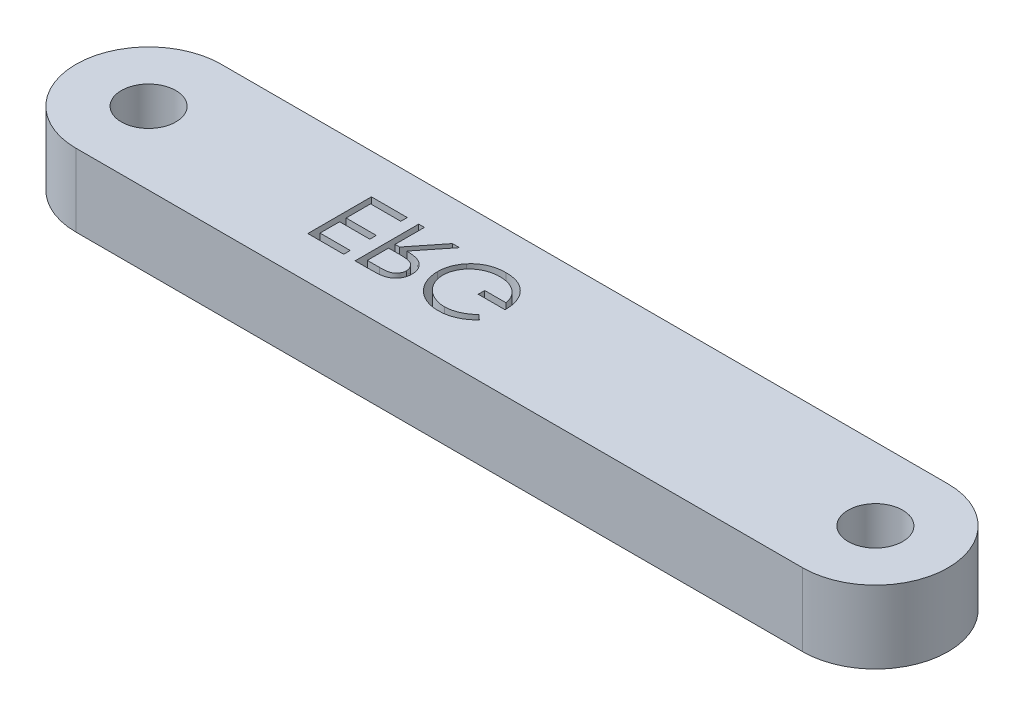
from build123d import *

# Parameters (mm, degrees)
SKETCH2_R           = 15
BOSS_EXTRUDE1_DEPTH = 20
CUT_EXTRUDE1_DEPTH  = 444.621460256


with BuildPart() as part:
    # Sketch2 → Boss-Extrude1 (new, symmetric)
    with BuildSketch(Plane(origin=(0, 0, 0), x_dir=(1, 0, 0), z_dir=(0, 1, 0))):
        with BuildLine():
            Line((0, 40), (400, 40))
            ThreePointArc((400, 40), (440, 0), (400, -40))
            Line((400, -40), (0, -40))
            ThreePointArc((0, -40), (-40, 0), (0, 40))
        make_face()
        with Locations(Location((0, 0, 0), (0, 0, 270))):
            Circle(SKETCH2_R, mode=Mode.SUBTRACT)
        with Locations(Location((400, 0, 0), (0, 0, 270))):
            Circle(SKETCH2_R, mode=Mode.SUBTRACT)
    extrude(amount=BOSS_EXTRUDE1_DEPTH, both=True)

    # Sketch3 → Cut-Extrude1 (cut, through all)
    # profile 1 of 3: a face of its own
    with BuildSketch(Plane.XZ.offset(20)):
        Polygon((104.487179487, 16.860888032), (124.230769231, 16.860888032), (124.230769231, 13.271144442), (107.628205128, 13.271144442), (107.628205128, 2.501913673), (124.230769231, 2.501913673), (124.230769231, -1.087829917), (107.628205128, -1.087829917), (107.628205128, -14.549368378), (124.230769231, -14.549368378), (124.230769231, -18.139111968), (104.487179487, -18.139111968), align=None)
    # profile 2 of 3: a face of its own
    with BuildSketch(Plane.XZ.offset(20)):
        with BuildLine():
            Line((130.512820513, 16.860888032), (137.517027244, 16.860888032))
            add(Edge.make_bspline(
                [(137.517027244, 16.860888032), (137.984438529, 16.859332172), (138.881919973, 16.856344749), (140.167652676, 16.83968712), (141.335923646, 16.791943562), (142.38612204, 16.750857728), (143.318228589, 16.675938314), (144.135101497, 16.604331843), (144.832978472, 16.510595235), (145.255436985, 16.423541006), (145.446714744, 16.384125211)],
                knots=[0, 0, 0, 0, 1.410062039, 2.707475311, 3.878576406, 4.937260626, 5.877586885, 6.699081471, 7.410979367, 8, 8, 8, 8], degree=3))
            add(Edge.make_bspline(
                [(145.446714744, 16.384125211), (145.702780985, 16.320857558), (146.20945088, 16.195671921), (146.93895154, 15.931075913), (147.63409478, 15.624879667), (148.291993023, 15.265242463), (148.909350935, 14.849494667), (149.492534043, 14.384813442), (150.044188676, 13.873741385), (150.542004978, 13.30339297), (151.011395495, 12.705027873), (151.40728176, 12.057990304), (151.748546557, 11.381375029), (152.020251727, 10.668300852), (152.239031462, 9.925683133), (152.393293856, 9.146795166), (152.485805732, 8.335185415), (152.495224288, 7.781606327), (152.5, 7.50091207)],
                knots=[0, 0, 0, 0, 1.027469482, 2.033020251, 3.019912614, 3.986113645, 4.951240523, 5.91722682, 6.890402269, 7.87763091, 8.8651537, 9.85103654, 10.82876324, 11.815024772, 12.821070561, 13.842952187, 14.906261191, 16, 16, 16, 16], degree=3))
            add(Edge.make_bspline(
                [(152.5, 7.50091207), (152.485310019, 7.034561024), (152.456646061, 6.124589345), (152.189395024, 4.803980531), (151.751629827, 3.572087385), (151.148396937, 2.430461006), (150.38020218, 1.401354552), (149.456954269, 0.497449999), (148.378138154, -0.258949127), (147.373844994, -0.783477174), (146.486702997, -1.11940626), (145.75636987, -1.355769849), (144.959700095, -1.538389502), (144.104326749, -1.701990819), (143.186690194, -1.825507763), (142.2089898, -1.915973708), (141.170528283, -1.972514195), (140.45713759, -1.980934244), (140.090144231, -1.985265814)],
                knots=[0, 0, 0, 0, 1.260483769, 2.459530307, 3.627416485, 4.787058657, 5.939039949, 7.08810263, 8.267026773, 9.491475466, 10.141966685, 10.831826277, 11.566392101, 12.351337768, 13.187381173, 14.07005841, 15.007169909, 16, 16, 16, 16], degree=3))
            Line((140.090144231, -1.985265814), (152.948717949, -18.139111968))
            Line((152.948717949, -18.139111968), (149.064503205, -18.139111968))
            Line((149.064503205, -18.139111968), (136.205929487, -1.985265814))
            Line((136.205929487, -1.985265814), (133.653846154, -1.985265814))
            Line((133.653846154, -1.985265814), (133.653846154, -18.139111968))
            Line((133.653846154, -18.139111968), (130.512820513, -18.139111968))
            Line((130.512820513, -18.139111968), (130.512820513, 16.860888032))
        make_face()
        with BuildLine():
            Line((133.653846154, 13.271144442), (133.653846154, 1.604477775))
            Line((133.653846154, 1.604477775), (140.062099359, 1.55539925))
            add(Edge.make_bspline(
                [(140.062099359, 1.55539925), (140.361299748, 1.555266883), (140.941235319, 1.555010319), (141.780241968, 1.594948082), (142.561443084, 1.640381264), (143.281850606, 1.709874719), (143.941786359, 1.799435437), (144.540920492, 1.911465279), (145.08023101, 2.041985906), (145.709216395, 2.244002164), (146.411581708, 2.564062346), (147.174896307, 3.029717333), (147.824919685, 3.615408525), (148.374098308, 4.285143085), (148.815392622, 5.021505574), (149.126513166, 5.815669266), (149.323937589, 6.647585246), (149.347223043, 7.219366324), (149.358974359, 7.507923288)],
                knots=[0, 0, 0, 0, 1.146690395, 2.22261258, 3.21895312, 4.145990853, 4.996080663, 5.770904154, 6.481378293, 7.121626537, 8.300444488, 9.431385265, 10.535395872, 11.636531494, 12.74115979, 13.810798291, 14.895190096, 16, 16, 16, 16], degree=3))
            add(Edge.make_bspline(
                [(149.358974359, 7.507923288), (149.346953148, 7.789389026), (149.323131495, 8.347151412), (149.128643809, 9.163710515), (148.799749996, 9.934380017), (148.356527616, 10.656024866), (147.816536067, 11.311082225), (147.18335794, 11.871553756), (146.474305988, 12.334048402), (145.811594005, 12.629592207), (145.21925188, 12.81079074), (144.70495528, 12.938302378), (144.123840502, 13.040747067), (143.473085916, 13.122827676), (142.755469608, 13.193377119), (141.967363097, 13.240894905), (141.113995295, 13.269033546), (140.522525983, 13.270424435), (140.216346154, 13.271144442)],
                knots=[0, 0, 0, 0, 1.101028733, 2.181837193, 3.264309656, 4.369019818, 5.486613113, 6.575447106, 7.666700264, 8.788928104, 9.402425223, 10.0903467, 10.862060571, 11.710948788, 12.657782767, 13.684531032, 14.801375019, 16, 16, 16, 16], degree=3))
            Line((140.216346154, 13.271144442), (133.653846154, 13.271144442))
        make_face(mode=Mode.SUBTRACT)
    # profile 3 of 3: a face of its own
    with BuildSketch(Plane.XZ.offset(20)):
        with BuildLine():
            Line((192.884615385, 10.88733034), (190.192307692, 8.335247006))
            add(Edge.make_bspline(
                [(190.192307692, 8.335247006), (189.705118811, 8.793555636), (188.742358346, 9.699244265), (187.172755919, 10.874354217), (185.53511958, 11.881015218), (183.837994611, 12.700077583), (182.123409072, 13.353605188), (180.414121309, 13.81888659), (178.727664295, 14.115611965), (177.605992111, 14.151095658), (177.053285256, 14.16858034)],
                knots=[0, 0, 0, 0, 1.08915593, 2.152340314, 3.188132944, 4.216796309, 5.218260357, 6.173443236, 7.099959455, 8, 8, 8, 8], degree=3))
            add(Edge.make_bspline(
                [(177.053285256, 14.16858034), (176.714138257, 14.164444281), (176.036723851, 14.15618289), (175.03050441, 14.050740737), (174.03483804, 13.899092097), (173.051604293, 13.67967332), (172.078891429, 13.401582725), (171.120082507, 13.053728092), (170.17338896, 12.64817565), (169.247728149, 12.179550912), (168.350323114, 11.664752448), (167.502754757, 11.094267042), (166.699620769, 10.486379144), (165.956016515, 9.825869349), (165.267664648, 9.118720696), (164.618180929, 8.378087634), (164.03040797, 7.583735449), (163.499496321, 6.750279188), (163.025880137, 5.892357296), (162.607793601, 5.018227399), (162.25682272, 4.130788855), (161.979128167, 3.228928078), (161.750021628, 2.319622179), (161.588845556, 1.396574974), (161.497978335, 0.458798121), (161.482260535, -0.169174463), (161.474358974, -0.484865173)],
                knots=[0, 0, 0, 0, 1.02818874, 2.053710826, 3.065248034, 4.081641283, 5.106893873, 6.131558223, 7.173050175, 8.228653731, 9.27666206, 10.308777013, 11.325269123, 12.329503258, 13.32196095, 14.316845687, 15.314881793, 16.315733098, 17.311955233, 18.285320748, 19.252783886, 20.203351036, 21.145449891, 22.095197417, 23.042428769, 24, 24, 24, 24], degree=3))
            add(Edge.make_bspline(
                [(161.474358974, -0.484865173), (161.481916157, -0.807573346), (161.497009886, -1.452108481), (161.593613082, -2.414049207), (161.772895486, -3.361703231), (162.012572575, -4.298184562), (162.312380732, -5.225097041), (162.686107392, -6.13842214), (163.128763398, -7.038126052), (163.641128918, -7.916102221), (164.202990953, -8.771332454), (164.832421763, -9.576927672), (165.501027597, -10.343615445), (166.233166595, -11.054373083), (167.005362018, -11.728212046), (167.840684778, -12.346567265), (168.722709383, -12.921349498), (169.652781501, -13.445314691), (170.620809326, -13.913400048), (171.613376857, -14.32963901), (172.633655013, -14.672432382), (173.676281909, -14.951813423), (174.740014626, -15.180816395), (175.830252653, -15.328141198), (176.938979737, -15.435049507), (177.686366058, -15.442866208), (178.062900641, -15.446804276)],
                knots=[0, 0, 0, 0, 0.93586088, 1.869166235, 2.799637598, 3.729985548, 4.670839027, 5.622275134, 6.589130586, 7.576015415, 8.568469353, 9.55398029, 10.53834874, 11.515998671, 12.510579167, 13.508179873, 14.527009472, 15.561807829, 16.601455013, 17.643573243, 18.680854198, 19.719860599, 20.772568776, 21.833555941, 22.908541556, 24, 24, 24, 24], degree=3))
            add(Edge.make_bspline(
                [(178.062900641, -15.446804276), (178.516684113, -15.437318513), (179.407761686, -15.418691676), (180.717626113, -15.273688782), (181.97565682, -15.047220845), (183.178318853, -14.715561878), (184.32700906, -14.292525128), (185.425938473, -13.782571264), (186.46645506, -13.166140673), (187.451686795, -12.470402002), (188.35925865, -11.695253677), (189.177799891, -10.858809126), (189.894254783, -9.965128459), (190.519301776, -9.019475306), (191.036388319, -8.014022256), (191.46081627, -6.953696631), (191.786149186, -5.838021512), (191.919698935, -5.067105195), (191.987179487, -4.677573507)],
                knots=[0, 0, 0, 0, 1.13008108, 2.219097802, 3.278683437, 4.311054135, 5.322181354, 6.324827112, 7.324222904, 8.330512327, 9.32562643, 10.293043162, 11.24128371, 12.174520618, 13.111833804, 14.052305215, 15.015860969, 16, 16, 16, 16], degree=3))
            Line((191.987179487, -4.677573507), (180.320512821, -4.677573507))
            Line((180.320512821, -4.677573507), (180.320512821, -1.087829917))
            Line((180.320512821, -1.087829917), (195.128205128, -1.087829917))
            add(Edge.make_bspline(
                [(195.128205128, -1.087829917), (195.111146644, -1.756904805), (195.07776011, -3.066405223), (194.843570954, -4.976107931), (194.465405831, -6.779824864), (193.948802712, -8.479455581), (193.280049909, -10.072591508), (192.466324625, -11.56085017), (191.494603414, -12.934616978), (190.399498999, -14.205107015), (189.170499421, -15.338399136), (187.840813221, -16.334458516), (186.408243538, -17.173484669), (184.874145463, -17.856091293), (183.243541129, -18.388831242), (181.512657331, -18.766547009), (179.683841324, -18.992846643), (178.430474555, -19.021760437), (177.789463141, -19.036547866)],
                knots=[0, 0, 0, 0, 1.140356446, 2.231883559, 3.274166699, 4.278491846, 5.25512956, 6.21435461, 7.1637429, 8.11826594, 9.068280886, 10.0076534, 10.945064095, 11.891975133, 12.864533718, 13.863980011, 14.907571808, 16, 16, 16, 16], degree=3))
            add(Edge.make_bspline(
                [(177.789463141, -19.036547866), (177.394361787, -19.030856653), (176.615094579, -19.019631748), (175.464185298, -18.939858274), (174.345009092, -18.817052511), (173.257729003, -18.631601276), (172.198345582, -18.404454735), (171.172149732, -18.113587547), (170.175232312, -17.776900553), (169.206052456, -17.393943819), (168.273406988, -16.950227252), (167.373141818, -16.457130857), (166.500280561, -15.91719725), (165.660768911, -15.321088792), (164.850232696, -14.673264191), (164.07389826, -13.972425001), (163.327419479, -13.220713804), (162.859814844, -12.686923708), (162.624198718, -12.417958122)],
                knots=[0, 0, 0, 0, 1.107784379, 2.184907829, 3.233506516, 4.263428166, 5.276301166, 6.270063455, 7.25232949, 8.225834625, 9.190232166, 10.146266622, 11.1027726, 12.066435141, 13.031522626, 14.010570082, 14.99756817, 16, 16, 16, 16], degree=3))
            add(Edge.make_bspline(
                [(162.624198718, -12.417958122), (162.282339399, -11.991251592), (161.604295272, -11.14492142), (160.731513706, -9.788921976), (159.987499678, -8.384903374), (159.383821456, -6.928957091), (158.912440593, -5.422444962), (158.574378065, -3.86729205), (158.376305174, -2.261495745), (158.347769799, -1.174843098), (158.333333333, -0.625089532)],
                knots=[0, 0, 0, 0, 1.023165419, 2.029347347, 3.013907458, 3.994755782, 4.975994455, 5.96558838, 6.970761222, 8, 8, 8, 8], degree=3))
            add(Edge.make_bspline(
                [(158.333333333, -0.625089532), (158.338655715, -0.213427005), (158.349232833, 0.604666069), (158.477487995, 1.819239144), (158.661502175, 3.012246065), (158.931972721, 4.182711628), (159.272935368, 5.331417546), (159.698470228, 6.458897184), (160.193919188, 7.5658159), (160.769774149, 8.64455458), (161.410618744, 9.680798708), (162.106120947, 10.670376742), (162.86615695, 11.595267392), (163.678314945, 12.467183874), (164.552284847, 13.275172344), (165.479879084, 14.026713451), (166.461812513, 14.722815309), (167.501174312, 15.352513656), (168.582451157, 15.918149861), (169.703051171, 16.414041978), (170.86263228, 16.823875133), (172.052507057, 17.171612929), (173.281682063, 17.428764335), (174.541237432, 17.615251789), (175.837738552, 17.742857786), (176.714098845, 17.753120344), (177.158453526, 17.758323929)],
                knots=[0, 0, 0, 0, 1.008945113, 2.00506715, 2.99143336, 3.967273523, 4.948097931, 5.927297278, 6.919902385, 7.919676788, 8.923139349, 9.905703106, 10.883022732, 11.856032218, 12.825136022, 13.798837087, 14.781400844, 15.773989409, 16.776158564, 17.77167057, 18.775803737, 19.789618931, 20.80898985, 21.851988756, 22.910860228, 24, 24, 24, 24], degree=3))
            add(Edge.make_bspline(
                [(177.158453526, 17.758323929), (177.520835962, 17.752529012), (178.23939775, 17.741038372), (179.308655073, 17.661391891), (180.361385219, 17.53515308), (181.399149118, 17.362885214), (182.41841278, 17.128248309), (183.422079834, 16.847465462), (184.411605197, 16.520547236), (185.383887689, 16.130658773), (186.345464849, 15.688122524), (187.301683254, 15.1899883), (188.249275713, 14.627738253), (189.189885528, 13.999702898), (190.129444107, 13.31666872), (191.05309053, 12.559100483), (191.983119973, 11.756872925), (192.581138115, 11.180051086), (192.884615385, 10.88733034)],
                knots=[0, 0, 0, 0, 0.985871117, 1.954866573, 2.915460327, 3.869826059, 4.81536089, 5.759505086, 6.70452669, 7.649098992, 8.607881297, 9.583363685, 10.581137262, 11.603961102, 12.659522466, 13.73993555, 14.853081303, 16, 16, 16, 16], degree=3))
        make_face()
    extrude(amount=-CUT_EXTRUDE1_DEPTH, mode=Mode.SUBTRACT)


with BuildPart() as cut_extrude1_piece_1:
    # of the separate pieces the step leaves, piece 1, a body of its own (cut_extrude1_pieces)
    add(part.part.solids().sort_by_distance((400, -20, 40))[0])


with BuildPart() as cut_extrude1_piece_2:
    # of the separate pieces the step leaves, piece 2, a body of its own (cut_extrude1_pieces)
    add(part.part.solids().sort_by_distance((140.216346154, -20, 13.271144442))[0])


solid = Compound([cut_extrude1_piece_1.part, cut_extrude1_piece_2.part])
